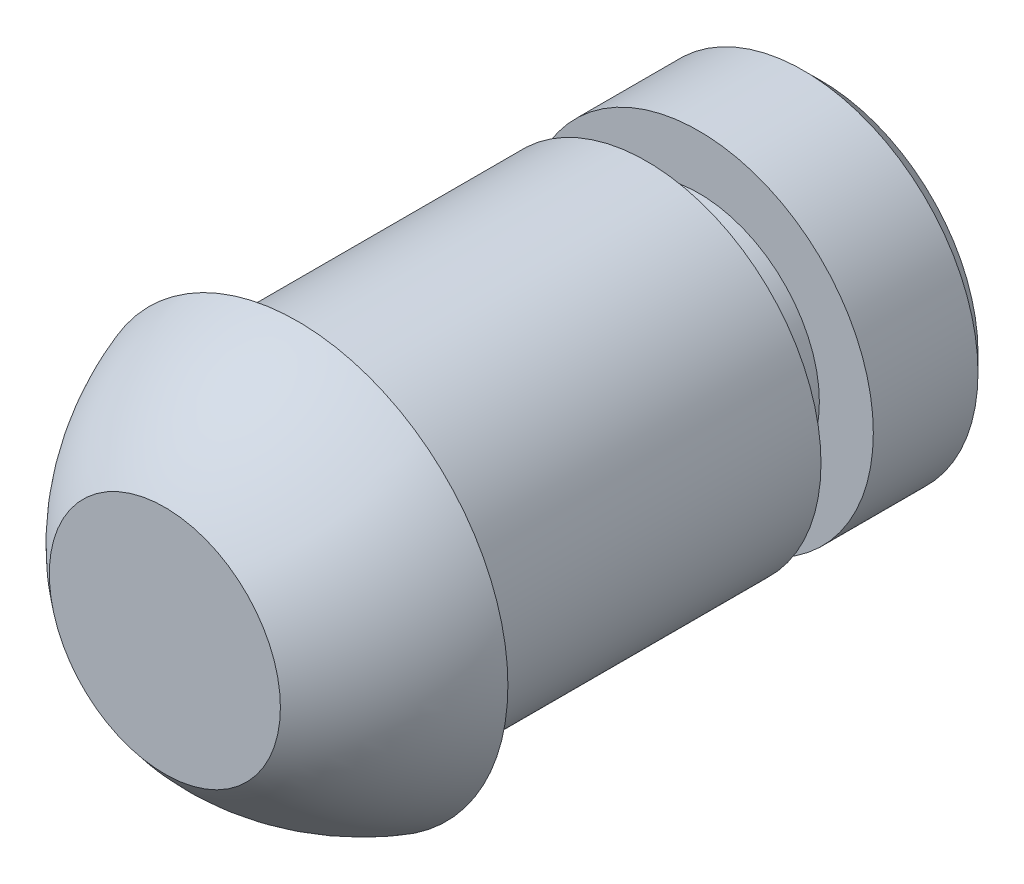
from build123d import *

# Parameters (mm, degrees)
CHAMFER1_SIZE = 0.2


with BuildPart() as part:
    # Sketch1 → Revolve1 (revolve)
    with BuildSketch(Plane(origin=(0, 0, 0), x_dir=(0, 0, -1), z_dir=(1, 0, 0)), mode=Mode.PRIVATE) as revolve1_sk:
        with BuildLine():
            Line((-1.80638465, 0), (2.358456395, 0))
            Line((2.358456395, 0), (4.154321235, 0))
            Line((4.154321235, 0), (4.154321235, 2))
            Line((4.154321235, 2), (2.754321235, 2))
            Line((2.754321235, 2), (2.754321235, 1.381443299))
            Line((2.754321235, 1.381443299), (2.154321235, 1.381443299))
            Line((2.154321235, 1.381443299), (2.154321235, 2))
            Line((2.154321235, 2), (-1.845678765, 2))
            Line((-1.845678765, 2), (-1.845678765, 2.410234036))
            ThreePointArc((-1.845678765, 2.410234036), (-2.687941743, 1.981004397), (-3.368605566, 1.325))
            Line((-3.368605566, 1.325), (-3.368605566, 0))
            Line((-3.368605566, 0), (-1.80638465, 0))
        make_face()
    revolve(revolve1_sk.sketch.rotate(Axis((0, 0, 1.80638465), (0, 0, -1)), 90), axis=Axis((0, 0, 1.80638465), (0, 0, -1)))

    # Chamfer1
    chamfer1_edges = [part.edges().sort_by_distance(p)[0] for p in [
        (-2, 0, -4.154321235),
    ]]
    chamfer(chamfer1_edges, length=CHAMFER1_SIZE)


solid = part.part
